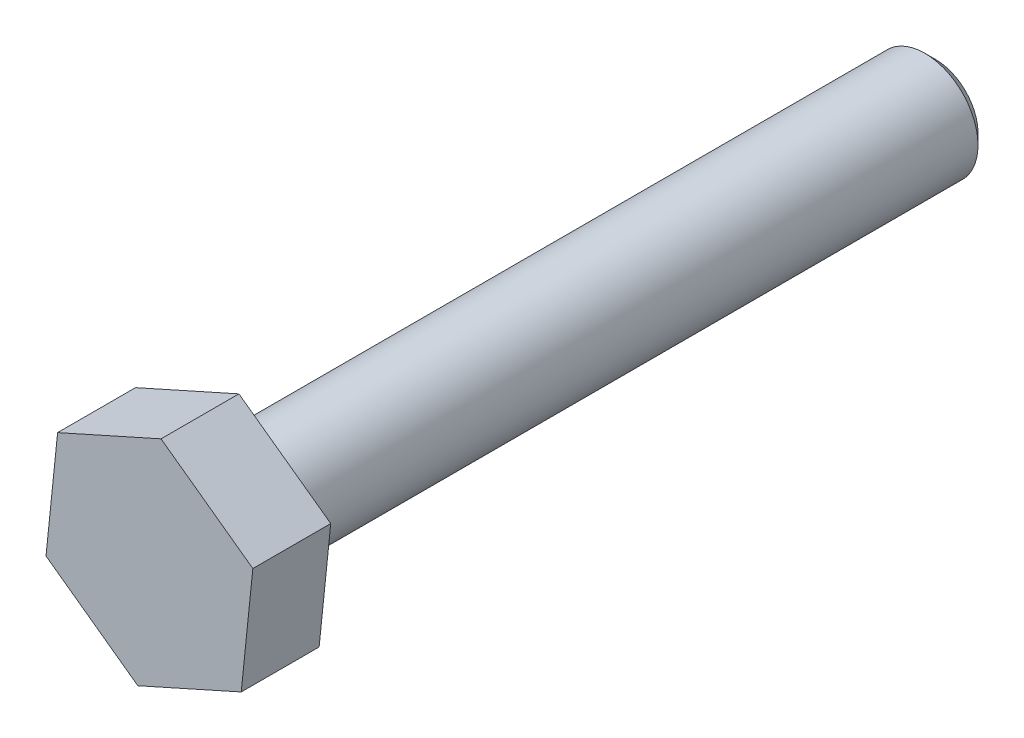
from build123d import *

# Parameters (mm, degrees)
BOSS_EXTRUDE1_DEPTH = 2.2
SKETCH2_R           = 1.5
BOSS_EXTRUDE2_DEPTH = 20
CHAMFER1_SIZE       = 0.3


with BuildPart() as part:
    # Sketch1 → Boss-Extrude1 (new body)
    with BuildSketch(Plane.XY):
        Polygon((2.592758174, -1.87552794), (2.920633928, 1.307630474), (0.327875755, 3.183158414), (-2.592758174, 1.87552794), (-2.920633928, -1.307630474), (-0.327875755, -3.183158414), align=None)
    extrude(amount=BOSS_EXTRUDE1_DEPTH)

    # Sketch2 → Boss-Extrude2 (add)
    with BuildSketch(Plane(origin=(0, 0, 0), x_dir=(-1, 0, 0), z_dir=(0, 0, -1))):
        with Locations(Location((0, 0, 0), (0, 0, 180))):
            Circle(SKETCH2_R)
    extrude(amount=BOSS_EXTRUDE2_DEPTH)

    # Chamfer1
    chamfer1_edges = [part.edges().sort_by_distance(p)[0] for p in [
        (-1.5, 0, -20),
    ]]
    chamfer(chamfer1_edges, length=CHAMFER1_SIZE)


solid = part.part
